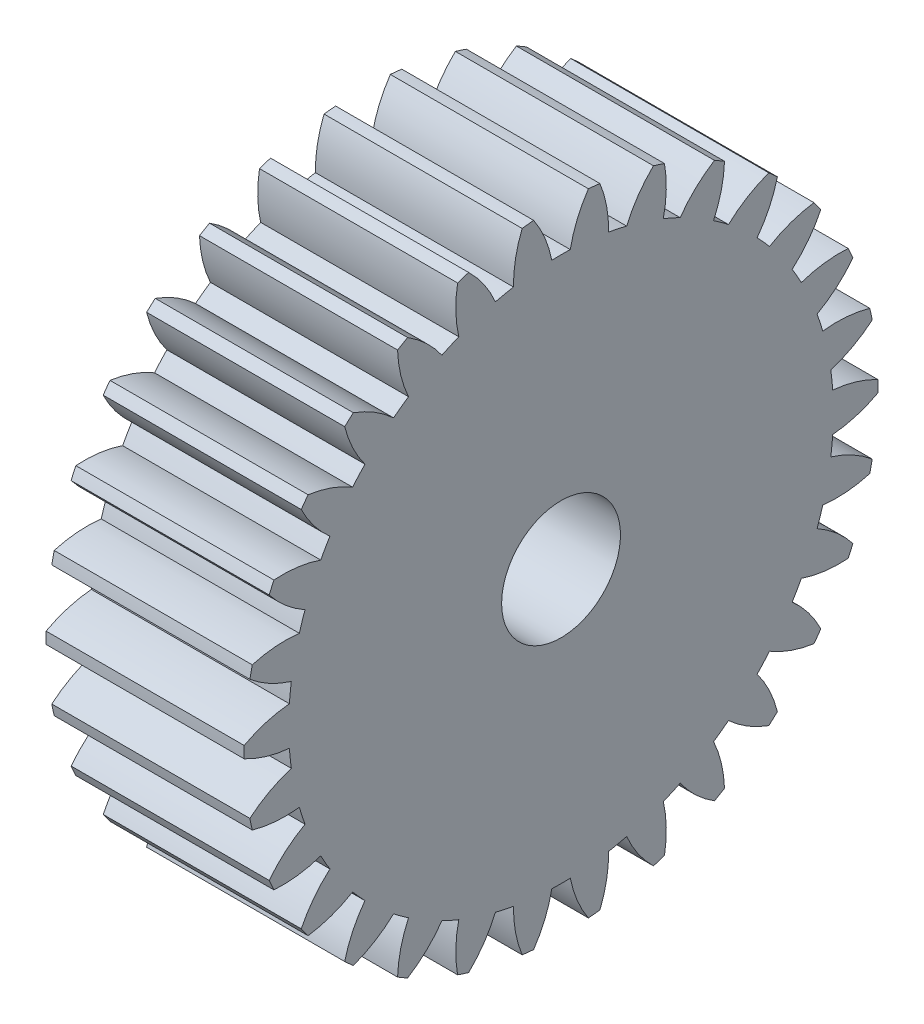
from build123d import *

# Parameters (mm, degrees)
BASPROSKE_W     = 5
BASPROSKE_H     = 8
TOOTHCUT_DEPTH  = 13.369316877
TEETHCUTS_COUNT = 30
TEETHCUTS_ANGLE = 348
BORSKE_R        = 1.5
BORE_DEPTH      = 50.0000508


with BuildPart() as part:
    # BasProSke → Base-Revolve (revolve)
    with BuildSketch(Plane(origin=(0, 0, 0), x_dir=(1, 0, 0), z_dir=(0, 1, 0)), mode=Mode.PRIVATE) as base_revolve_sk:
        with Locations((2.5, 4)):
            Rectangle(BASPROSKE_W, BASPROSKE_H)
    revolve(base_revolve_sk.sketch.rotate(Axis((-10, 0, 0), (1, 0, 0)), 180), axis=Axis((-10, 0, 0), (1, 0, 0)))

    # TooCutSke → ToothCut (cut, through all)
    with BuildSketch(Plane(origin=(0, 0, 0), x_dir=(0, 0, -1), z_dir=(1, 0, 0))):
        with BuildLine():
            ThreePointArc((0.233102578, 6.87004652), (0, 6.874), (-0.233102578, 6.87004652))
            ThreePointArc((-0.233102578, 6.87004652), (-0.41229689, 7.456465027), (-0.706981715, 7.994199273))
            ThreePointArc((-0.706981715, 7.994199273), (0, 8.0254), (0.706981715, 7.994199273))
            ThreePointArc((0.706981715, 7.994199273), (0.41229689, 7.456465027), (0.233102578, 6.87004652))
        make_face()
    toothcut = extrude(amount=TOOTHCUT_DEPTH, mode=Mode.SUBTRACT)

    # TeethCuts: ToothCut ×30 about axis
    teethcuts_axis = Axis((-10, 0, 0), (1, 0, 0))
    for i in range(1, TEETHCUTS_COUNT):
        add(toothcut.rotate(teethcuts_axis, i * TEETHCUTS_ANGLE / (TEETHCUTS_COUNT - 1)), mode=Mode.SUBTRACT)

    # BorSke → Bore (cut, symmetric)
    with BuildSketch(Plane(origin=(0, 0, 0), x_dir=(0, 0, -1), z_dir=(1, 0, 0))):
        with Locations(Location((0, 0, 0), (0, 0, 180))):
            Circle(BORSKE_R)
    extrude(amount=BORE_DEPTH, both=True, mode=Mode.SUBTRACT)


solid = part.part
